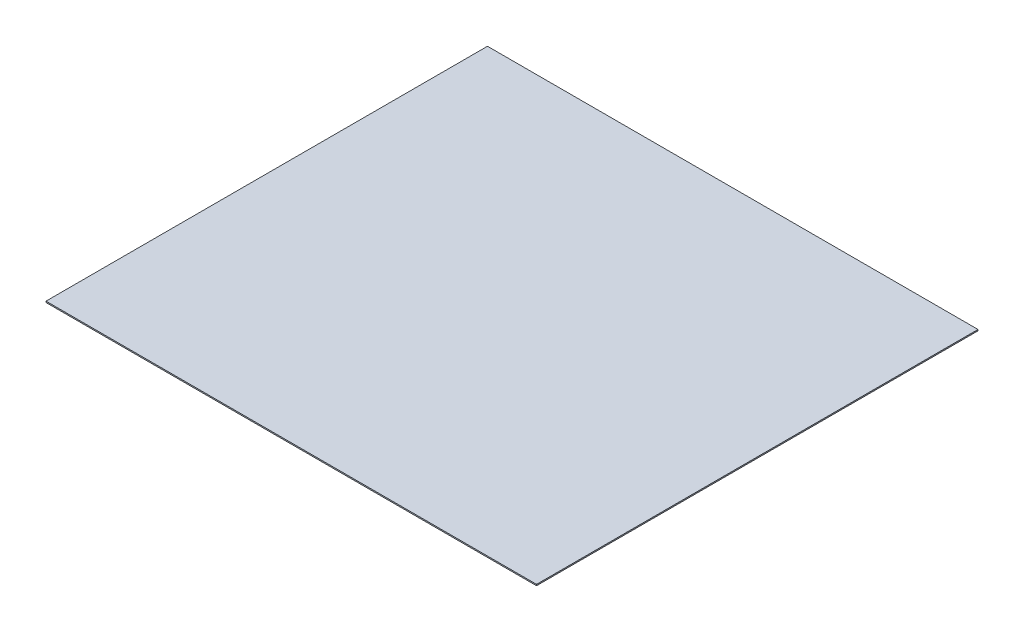
from build123d import *

# Parameters (mm, degrees)
SKETCH1_W           = 400
SKETCH1_H           = 360
BOSS_EXTRUDE1_DEPTH = 1


with BuildPart() as part:
    # Sketch1 → Boss-Extrude1 (new body)
    with BuildSketch(Plane(origin=(0, 0, 0), x_dir=(1, 0, 0), z_dir=(0, 1, 0))):
        with Locations((-20, 0)):
            Rectangle(SKETCH1_W, SKETCH1_H)
    extrude(amount=BOSS_EXTRUDE1_DEPTH)


solid = part.part
